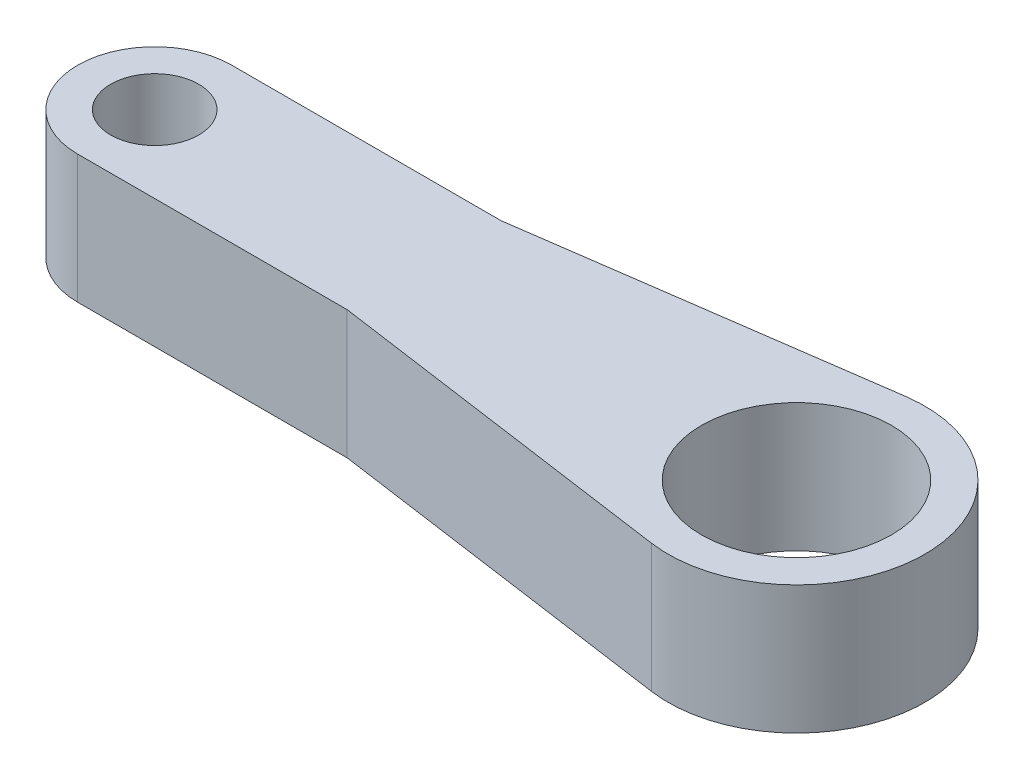
from build123d import *

# Parameters (mm, degrees)
SKETCH2_R           = 11.1
SKETCH2_R_2         = 5.15
BOSS_EXTRUDE2_DEPTH = 7.5


with BuildPart() as part:
    # Sketch2 → Boss-Extrude2 (new, symmetric)
    with BuildSketch(Plane(origin=(0, 0, 0), x_dir=(1, 0, 0), z_dir=(0, 1, 0))):
        with BuildLine():
            Line((-43.5, 9), (-75, 9))
            ThreePointArc((-75, 9), (-84, 0), (-75, -9))
            Line((-75, -9), (-43.5, -9))
            Line((-43.5, -9), (-2.099515649, -14.852341029))
            ThreePointArc((-2.099515649, -14.852341029), (15, 0), (-2.099515649, 14.852341029))
            Line((-2.099515649, 14.852341029), (-43.5, 9))
        make_face()
        Circle(SKETCH2_R, mode=Mode.SUBTRACT)
        with Locations((-75, 0)):
            Circle(SKETCH2_R_2, mode=Mode.SUBTRACT)
    extrude(amount=BOSS_EXTRUDE2_DEPTH, both=True)


solid = part.part
